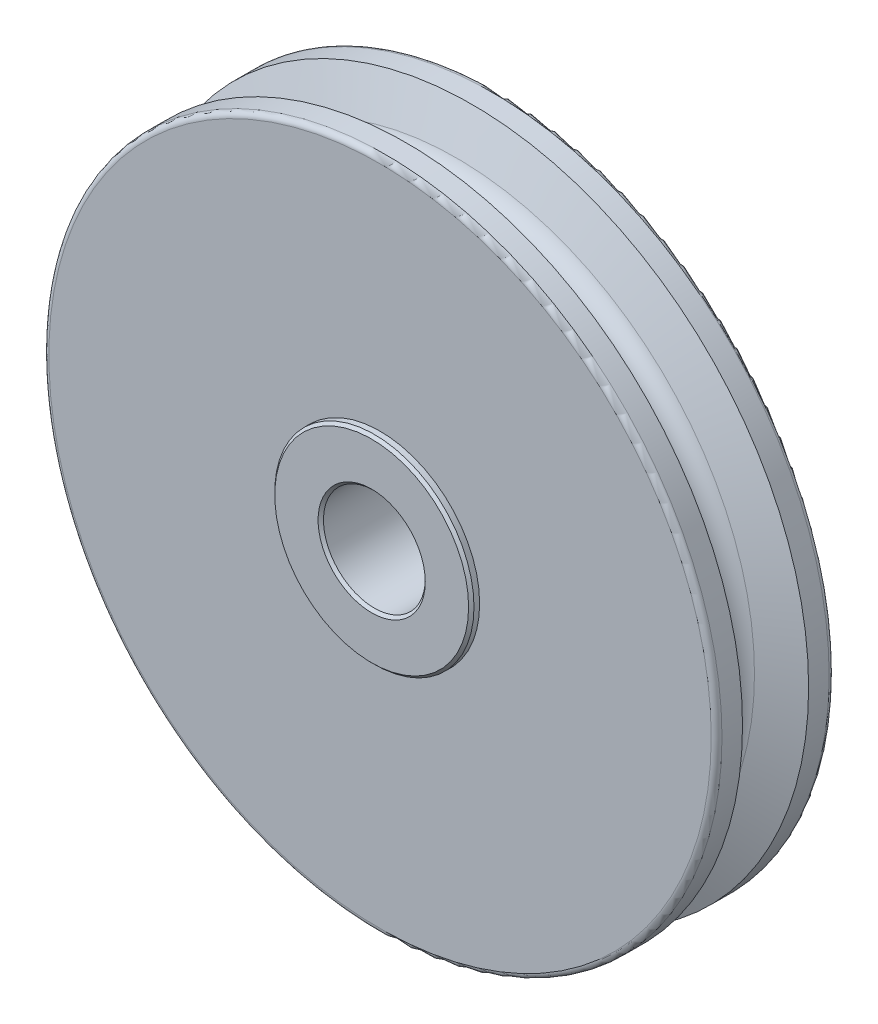
from build123d import *


with BuildPart() as part:
    # Sketch2 → Bushing Revolve (revolve)
    with BuildSketch(Plane(origin=(0, 0, 0), x_dir=(0, 0, -1), z_dir=(1, 0, 0)), mode=Mode.PRIVATE) as bushing_revolve_sk:
        Polygon((-3.175, 4.572), (-3.175, 2.5273), (-3.048, 2.4003), (3.048, 2.4003), (3.175, 2.5273), (3.175, 4.572), (3.048, 4.699), (-3.048, 4.699), align=None)
    revolve(bushing_revolve_sk.sketch.rotate(Axis((0, 0, 3.175), (0, 0, -1)), 90), axis=Axis((0, 0, 3.175), (0, 0, -1)))


with BuildPart() as body_2:
    # Sketch3 → Sheave Revolve (revolve)
    with BuildSketch(Plane(origin=(0, 0, 0), x_dir=(0, 0, -1), z_dir=(1, 0, 0)), mode=Mode.PRIVATE) as sheave_revolve_sk:
        with BuildLine():
            Line((2.7813, 4.699), (-2.7813, 4.699))
            Line((-2.7813, 4.699), (-2.7813, 15.621))
            ThreePointArc((-2.7813, 15.621), (-2.706905122, 15.800605122), (-2.5273, 15.875))
            Line((-2.5273, 15.875), (-1.559159955, 15.875))
            Line((-1.559159955, 15.875), (-0.824266447, 14.056074738))
            ThreePointArc((-0.824266447, 14.056074738), (0, 13.5001), (0.824266447, 14.056074738))
            Line((0.824266447, 14.056074738), (1.559159955, 15.875))
            Line((1.559159955, 15.875), (2.5273, 15.875))
            ThreePointArc((2.5273, 15.875), (2.706905122, 15.800605122), (2.7813, 15.621))
            Line((2.7813, 15.621), (2.7813, 4.699))
        make_face()
    revolve(sheave_revolve_sk.sketch.rotate(Axis((0, 0, 3.175), (0, 0, -1)), 90), axis=Axis((0, 0, 3.175), (0, 0, -1)))


solid = Compound([part.part, body_2.part])
